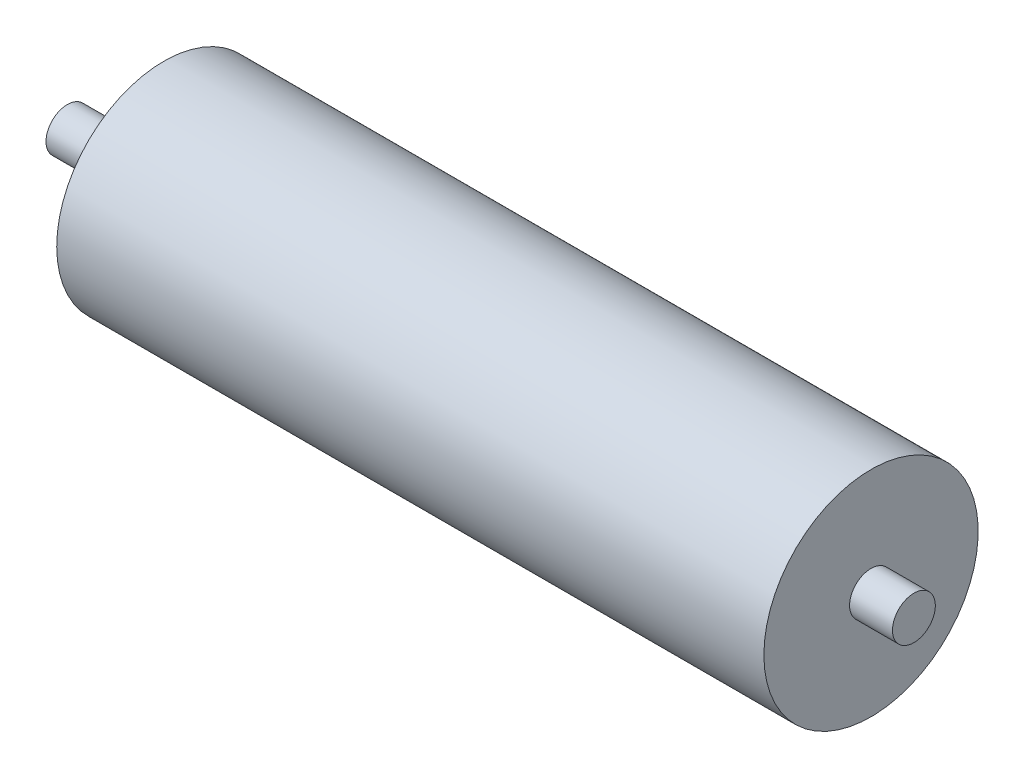
from build123d import *


with BuildPart() as part:
    # Sketch1 → Revolve1 (revolve)
    with BuildSketch(Plane.XY, mode=Mode.PRIVATE) as revolve1_sk:
        Polygon((-200.065055762, 0), (-200.065055762, 10), (-155.065055762, 10), (-155.065055762, 50), (174.934944238, 50), (174.934944238, 10), (194.934944238, 10), (194.934944238, 0), align=None)
    revolve(revolve1_sk.sketch.rotate(Axis((-200.065055762, 0, 0), (1, 0, 0)), 90), axis=Axis((-200.065055762, 0, 0), (1, 0, 0)))


solid = part.part
